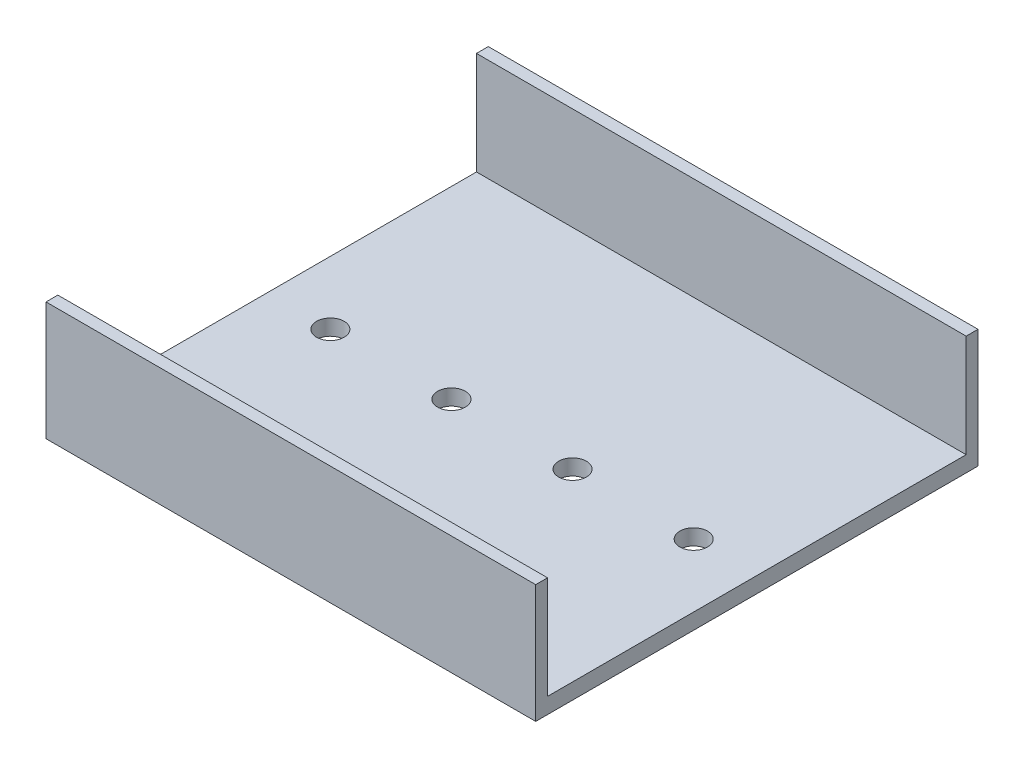
from build123d import *

# Parameters (mm, degrees)
SKETCH2_W           = 62
SKETCH2_H           = 56
BOSS_EXTRUDE1_DEPTH = 15
SKETCH3_W           = 62
SKETCH3_H           = 53
CUT_EXTRUDE1_DEPTH  = 13
SKETCH4_R           = 1.75
CUT_EXTRUDE2_DEPTH  = 85.551759296


with BuildPart() as part:
    # Sketch2 → Boss-Extrude1 (new body)
    with BuildSketch(Plane(origin=(0, 0, 0), x_dir=(1, 0, 0), z_dir=(0, 1, 0))):
        with Locations((31, 28)):
            Rectangle(SKETCH2_W, SKETCH2_H)
    extrude(amount=BOSS_EXTRUDE1_DEPTH)

    # Sketch3 → Cut-Extrude1 (cut)
    with BuildSketch(Plane(origin=(0, 15, 0), x_dir=(1, 0, 0), z_dir=(0, 1, 0))):
        with Locations((31, 28)):
            Rectangle(SKETCH3_W, SKETCH3_H)
    extrude(amount=-CUT_EXTRUDE1_DEPTH, mode=Mode.SUBTRACT)

    # Sketch4 → Cut-Extrude2 (cut, through all)
    with BuildSketch(Plane(origin=(0, 2, 0), x_dir=(1, 0, 0), z_dir=(0, 1, 0))):
        with Locations(Location((8, 28, 0), (0, 0, 270))):
            Circle(SKETCH4_R)
        with Locations(Location((23.333333333, 28, 0), (0, 0, 270))):
            Circle(SKETCH4_R)
        with Locations(Location((38.666666667, 28, 0), (0, 0, 270))):
            Circle(SKETCH4_R)
        with Locations(Location((54, 28, 0), (0, 0, 270))):
            Circle(SKETCH4_R)
    extrude(amount=-CUT_EXTRUDE2_DEPTH, mode=Mode.SUBTRACT)


solid = part.part
